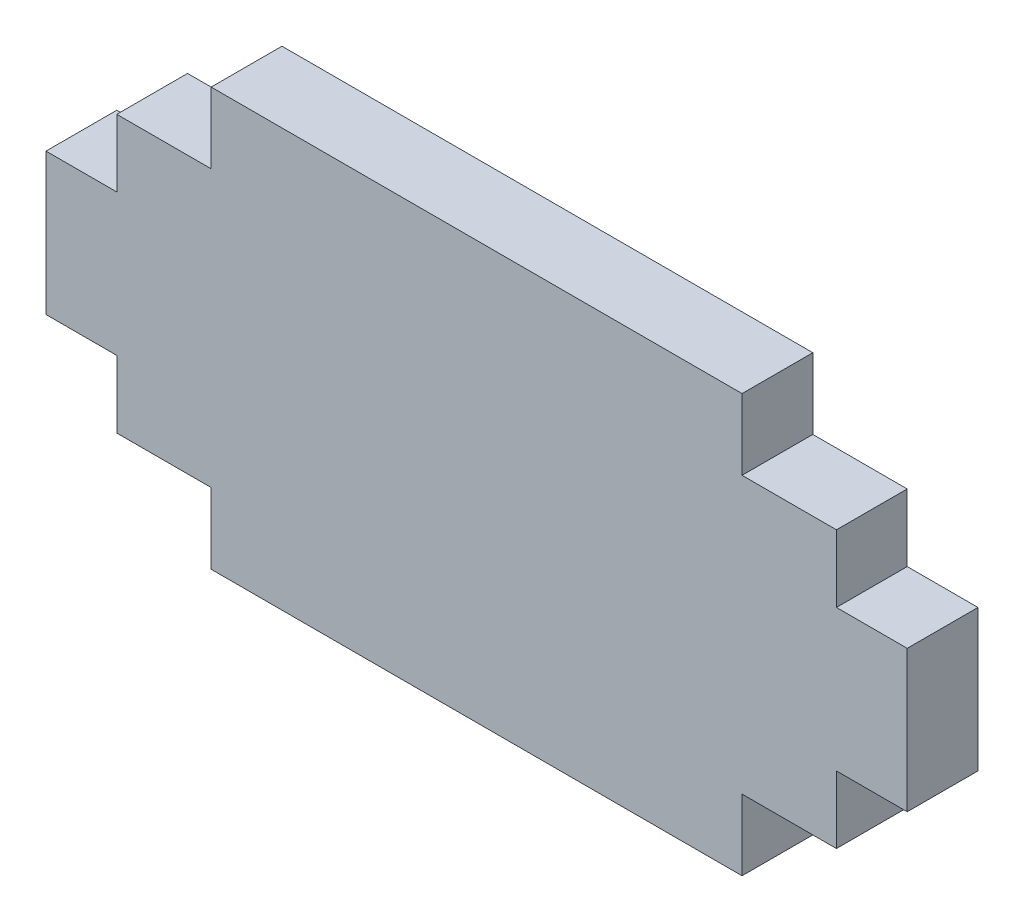
from build123d import *

# Parameters (mm, degrees)
LASER_PROFILE_3MM_DEPTH = 3


with BuildPart() as part:
    # Profile_Laser_profile_3mm → Laser_profile_3mm (new body)
    with BuildSketch(Plane.XY):
        Polygon((0, -5.85), (4, -5.85), (4, -8.85), (26.5, -8.85), (26.5, -5.85), (30.5, -5.85), (30.5, -3), (33.5, -3), (33.5, 3), (30.5, 3), (30.5, 5.85), (26.5, 5.85), (26.5, 8.85), (4, 8.85), (4, 5.85), (0, 5.85), (0, 3), (-3, 3), (-3, -3), (0, -3), align=None)
    extrude(amount=LASER_PROFILE_3MM_DEPTH)


solid = part.part
